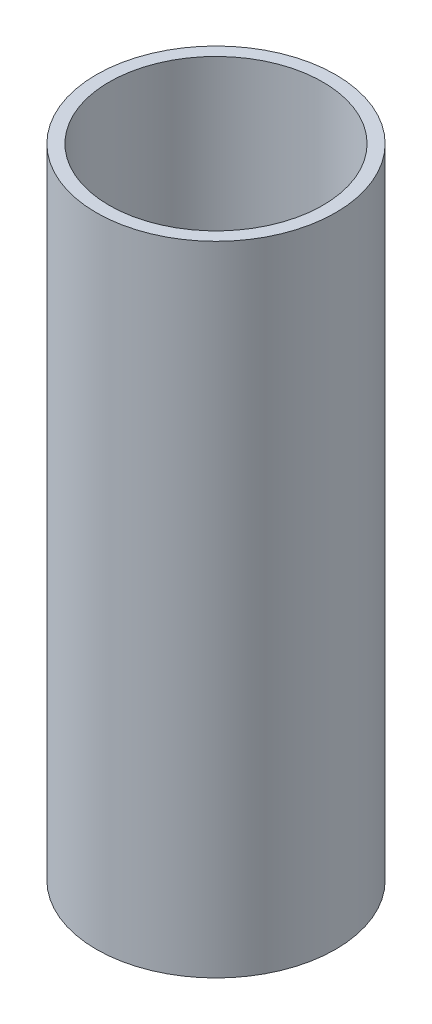
from build123d import *

# Parameters (mm, degrees)
SKETCH1_R           = 37.5
SKETCH1_R_2         = 33.5
BOSS_EXTRUDE1_DEPTH = 200


with BuildPart() as part:
    # Sketch1 → Boss-Extrude1 (new body)
    with BuildSketch(Plane(origin=(0, 0, 0), x_dir=(1, 0, 0), z_dir=(0, 1, 0))):
        with Locations(Location((0, 0, 0), (0, 0, 270))):
            Circle(SKETCH1_R)
        with Locations(Location((0, 0, 0), (0, 0, 270))):
            Circle(SKETCH1_R_2, mode=Mode.SUBTRACT)
    extrude(amount=BOSS_EXTRUDE1_DEPTH)


solid = part.part
